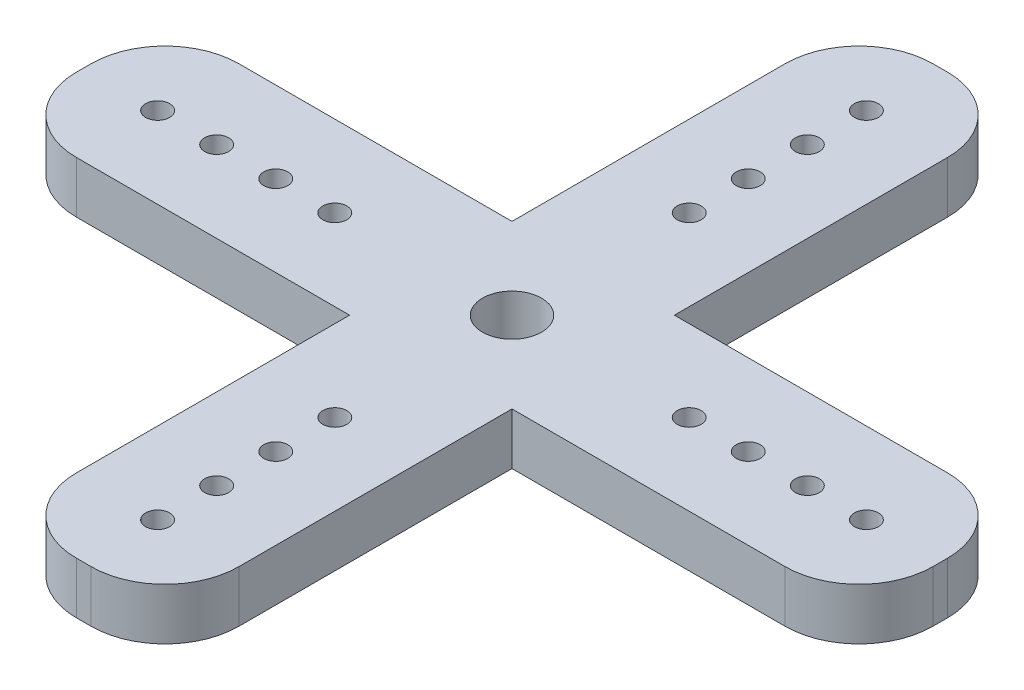
from build123d import *

# Parameters (mm, degrees)
SKETCH1_W                = 5.5
SKETCH1_H                = 14.5
SKETCH1_R                = 0.4064
BOSS_EXTRUDE1_DEPTH      = 1.75
FILLET1_R                = 2.5
CIRPATTERN1_COUNT        = 4
FILLET1_OF_CIRPATTERN1_R = 2.5
CUT_EXTRUDE1_REACH       = 22.581
SKETCH2_R                = 1


with BuildPart() as part:
    # Sketch1 → Boss-Extrude1 (new body)
    with BuildSketch(Plane(origin=(0, 0, 0), x_dir=(1, 0, 0), z_dir=(0, 1, 0))):
        with Locations((0, 7.25)):
            Rectangle(SKETCH1_W, SKETCH1_H)
        with Locations((0, 12)):
            Circle(SKETCH1_R, mode=Mode.SUBTRACT)
        with Locations((0, 10)):
            Circle(SKETCH1_R, mode=Mode.SUBTRACT)
        with Locations((0, 8)):
            Circle(SKETCH1_R, mode=Mode.SUBTRACT)
        with Locations((0, 6)):
            Circle(SKETCH1_R, mode=Mode.SUBTRACT)
    boss_extrude1 = extrude(amount=BOSS_EXTRUDE1_DEPTH)

    # Fillet1
    fillet1_edges = [part.edges().sort_by_distance(p)[0] for p in [
        (-2.75, 0.875, -14.5),
        (2.75, 0.875, -14.5),
    ]]
    fillet(fillet1_edges, radius=FILLET1_R)

    # CirPattern1: Boss-Extrude1 ×4 about axis
    cirpattern1_axis = Axis((0, 0, 0), (0, 1, 0))
    for i in range(1, CIRPATTERN1_COUNT):
        add(boss_extrude1.rotate(cirpattern1_axis, i * 360 / CIRPATTERN1_COUNT))

    # Fillet1 of CirPattern1
    fillet1_of_cirpattern1_edges = [part.edges().sort_by_distance(p)[0] for p in [
        (-14.5, 0.875, 2.75),
        (-14.5, 0.875, -2.75),
        (2.75, 0.875, 14.5),
        (-2.75, 0.875, 14.5),
        (14.5, 0.875, -2.75),
        (14.5, 0.875, 2.75),
    ]]
    fillet(fillet1_of_cirpattern1_edges, radius=FILLET1_OF_CIRPATTERN1_R)

    # Sketch2 → Cut-Extrude1 (cut, up to next)
    with BuildSketch(Plane(origin=(0, 1.75, 0), x_dir=(1, 0, 0), z_dir=(0, 1, 0)), mode=Mode.PRIVATE) as cut_extrude1_sk1:
        Circle(SKETCH2_R)
    cut_extrude1_tool1 = extrude(cut_extrude1_sk1.sketch, amount=-CUT_EXTRUDE1_REACH, mode=Mode.PRIVATE) & part.part
    add(cut_extrude1_tool1.solids().sort_by_distance((0, 1.75, 0))[0], mode=Mode.SUBTRACT)


solid = part.part
